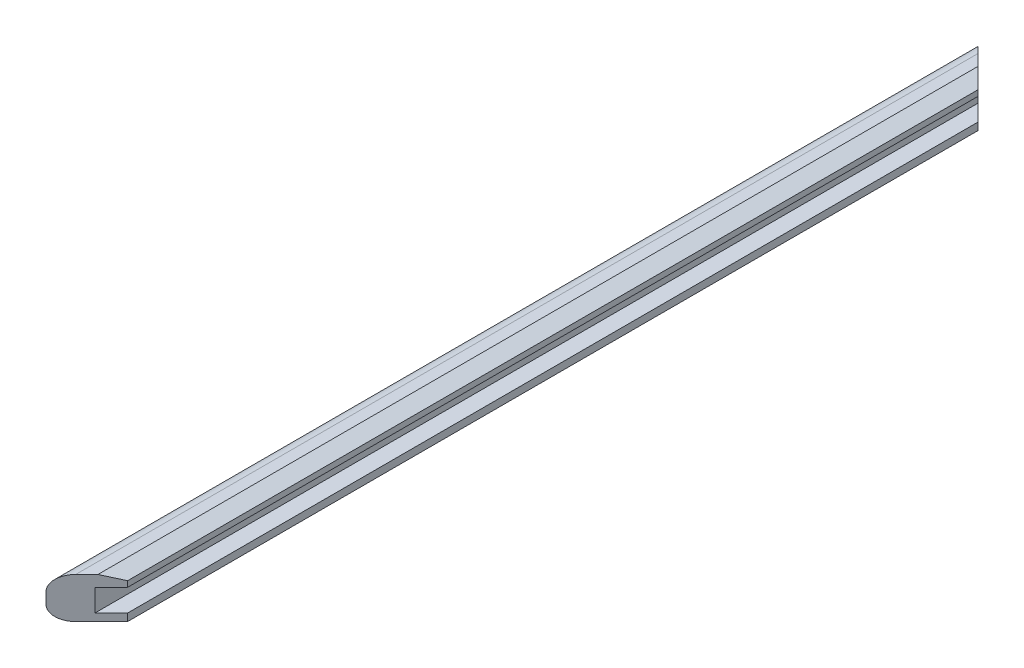
from build123d import *

# Parameters (mm, degrees)
SKETCH1_W           = 34.925
SKETCH1_H           = 34.925
BOSS_EXTRUDE1_DEPTH = 1320.8
SKETCH2_W           = 13.97
SKETCH2_H           = 19.05
CUT_EXTRUDE1_DEPTH  = 1322.030854224
FILLET1_R           = 12.7
CHAMFER1_SIZE       = 12.7
CHAMFER1_SIZE2      = 4.622421975
CUT_EXTRUDE2_DEPTH  = 1322.377059938


with BuildPart() as part:
    # Sketch1 → Boss-Extrude1 (new body)
    with BuildSketch(Plane.XY):
        Rectangle(SKETCH1_W, SKETCH1_H)
    extrude(amount=-BOSS_EXTRUDE1_DEPTH)

    # Sketch2 → Cut-Extrude1 (cut, through all)
    with BuildSketch(Plane.XY):
        with Locations((10.4775, -1.5875)):
            Rectangle(SKETCH2_W, SKETCH2_H)
    extrude(amount=-CUT_EXTRUDE1_DEPTH, mode=Mode.SUBTRACT)

    # Fillet1
    fillet1_edges = [part.edges().sort_by_distance(p)[0] for p in [
        (-17.4625, -17.4625, -660.4),
        (-17.4625, 17.4625, -660.4),
    ]]
    fillet(fillet1_edges, radius=FILLET1_R)

    # Chamfer1
    chamfer1_edges = [part.edges().sort_by_distance(p)[0] for p in [
        (17.4625, 17.4625, -660.4),
    ]]
    chamfer1_side = [part.faces().sort_by_distance(p)[0] for p in [
        (6.35, 17.4625, -660.4),
    ]]
    chamfer(chamfer1_edges, length=CHAMFER1_SIZE, length2=CHAMFER1_SIZE2, reference=chamfer1_side[0])

    # Sketch3 → Cut-Extrude2 (cut, through all)
    with BuildSketch(Plane(origin=(0, 17.4625, 0), x_dir=(1, 0, 0), z_dir=(0, 1, 0))):
        Polygon((-17.4625, 0), (17.4625, 34.925), (17.4625, 0), align=None)
        Polygon((-17.4625, 797.56), (17.4625, 762.635), (17.4625, 1320.8), (-17.4625, 1320.8), align=None)
    extrude(amount=-CUT_EXTRUDE2_DEPTH, mode=Mode.SUBTRACT)


solid = part.part
